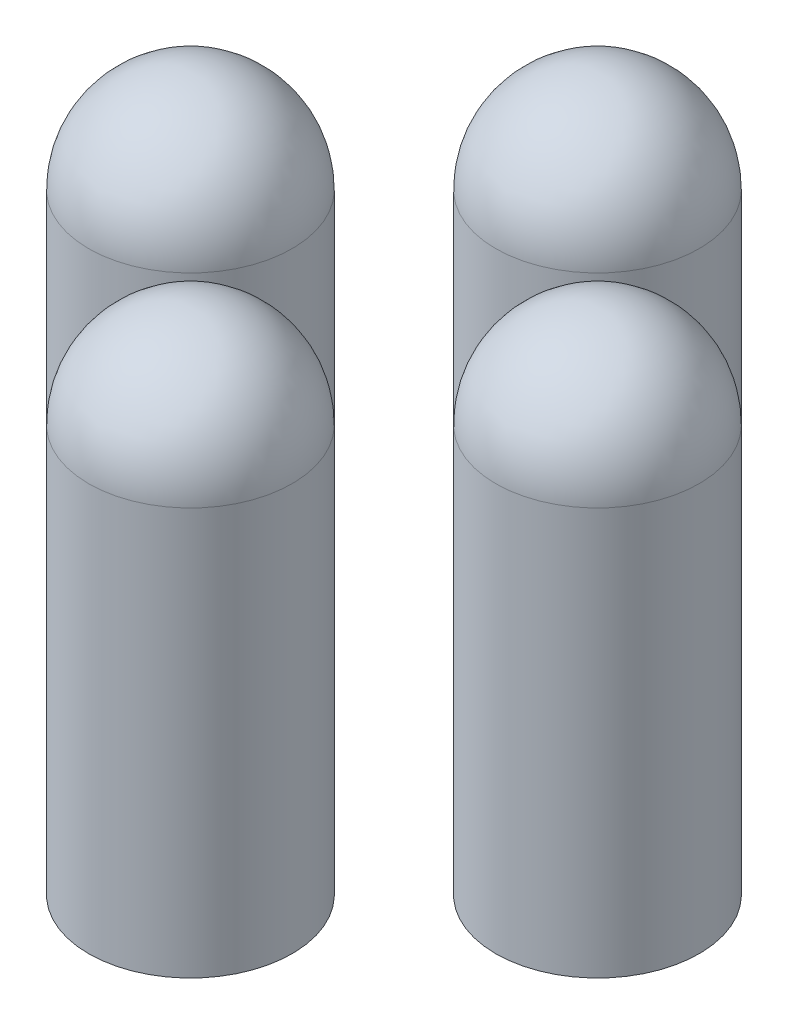
from build123d import *

# Parameters (mm, degrees)
SKETCH1_R             = 5
BOSS_EXTRUDE1_DEPTH   = 20
BOSS_EXTRUDE1_2_DEPTH = 20
BOSS_EXTRUDE1_3_DEPTH = 20
BOSS_EXTRUDE1_4_DEPTH = 20
DOME4_FACE_RADIUS     = 5
DOME4_HEIGHT          = 5
DOME5_FACE_RADIUS     = 5
DOME5_HEIGHT          = 5
DOME6_FACE_RADIUS     = 5
DOME6_HEIGHT          = 5
DOME7_FACE_RADIUS     = 5
DOME7_HEIGHT          = 5


with BuildPart() as part:
    # Sketch1 → Boss-Extrude1 (new body)
    with BuildSketch(Plane(origin=(0, 0, 0), x_dir=(1, 0, 0), z_dir=(0, 1, 0))):
        with Locations(Location((0, 0, 0), (0, 0, 270))):
            Circle(SKETCH1_R)
    extrude(amount=BOSS_EXTRUDE1_DEPTH)

    # Dome4: a dome of height H over a round flat face of radius A is a cap of a sphere of radius (A * A + H * H) / (2 * H)
    dome4_r = (DOME4_FACE_RADIUS * DOME4_FACE_RADIUS + DOME4_HEIGHT * DOME4_HEIGHT) / (2 * DOME4_HEIGHT)
    dome4_base = Plane((0, 20, 0), z_dir=(0, 1, 0))
    with Locations(dome4_base.offset(DOME4_HEIGHT - dome4_r)):
        dome4_ball = Sphere(dome4_r, mode=Mode.PRIVATE)
    add(split(dome4_ball, bisect_by=dome4_base, keep=Keep.TOP, mode=Mode.PRIVATE))


with BuildPart() as body_2:
    # Sketch1 → Boss-Extrude1 2 (new body)
    with BuildSketch(Plane(origin=(0, 0, 0), x_dir=(1, 0, 0), z_dir=(0, 1, 0))):
        with Locations(Location((10, 10, 0), (0, 0, 270))):
            Circle(SKETCH1_R)
    extrude(amount=BOSS_EXTRUDE1_2_DEPTH)

    # Dome5: a dome of height H over a round flat face of radius A is a cap of a sphere of radius (A * A + H * H) / (2 * H)
    dome5_r = (DOME5_FACE_RADIUS * DOME5_FACE_RADIUS + DOME5_HEIGHT * DOME5_HEIGHT) / (2 * DOME5_HEIGHT)
    dome5_base = Plane((10, 20, -10), z_dir=(0, 1, 0))
    with Locations(dome5_base.offset(DOME5_HEIGHT - dome5_r)):
        dome5_ball = Sphere(dome5_r, mode=Mode.PRIVATE)
    add(split(dome5_ball, bisect_by=dome5_base, keep=Keep.TOP, mode=Mode.PRIVATE))


with BuildPart() as body_3:
    # Sketch1 → Boss-Extrude1 3 (new body)
    with BuildSketch(Plane(origin=(0, 0, 0), x_dir=(1, 0, 0), z_dir=(0, 1, 0))):
        with Locations(Location((20, 0, 0), (0, 0, 270))):
            Circle(SKETCH1_R)
    extrude(amount=BOSS_EXTRUDE1_3_DEPTH)

    # Dome6: a dome of height H over a round flat face of radius A is a cap of a sphere of radius (A * A + H * H) / (2 * H)
    dome6_r = (DOME6_FACE_RADIUS * DOME6_FACE_RADIUS + DOME6_HEIGHT * DOME6_HEIGHT) / (2 * DOME6_HEIGHT)
    dome6_base = Plane((20, 20, 0), z_dir=(0, 1, 0))
    with Locations(dome6_base.offset(DOME6_HEIGHT - dome6_r)):
        dome6_ball = Sphere(dome6_r, mode=Mode.PRIVATE)
    add(split(dome6_ball, bisect_by=dome6_base, keep=Keep.TOP, mode=Mode.PRIVATE))


with BuildPart() as body_4:
    # Sketch1 → Boss-Extrude1 4 (new body)
    with BuildSketch(Plane(origin=(0, 0, 0), x_dir=(1, 0, 0), z_dir=(0, 1, 0))):
        with Locations(Location((10, -10, 0), (0, 0, 270))):
            Circle(SKETCH1_R)
    extrude(amount=BOSS_EXTRUDE1_4_DEPTH)

    # Dome7: a dome of height H over a round flat face of radius A is a cap of a sphere of radius (A * A + H * H) / (2 * H)
    dome7_r = (DOME7_FACE_RADIUS * DOME7_FACE_RADIUS + DOME7_HEIGHT * DOME7_HEIGHT) / (2 * DOME7_HEIGHT)
    dome7_base = Plane((10, 20, 10), z_dir=(0, 1, 0))
    with Locations(dome7_base.offset(DOME7_HEIGHT - dome7_r)):
        dome7_ball = Sphere(dome7_r, mode=Mode.PRIVATE)
    add(split(dome7_ball, bisect_by=dome7_base, keep=Keep.TOP, mode=Mode.PRIVATE))


solid = Compound([part.part, body_2.part, body_3.part, body_4.part])
